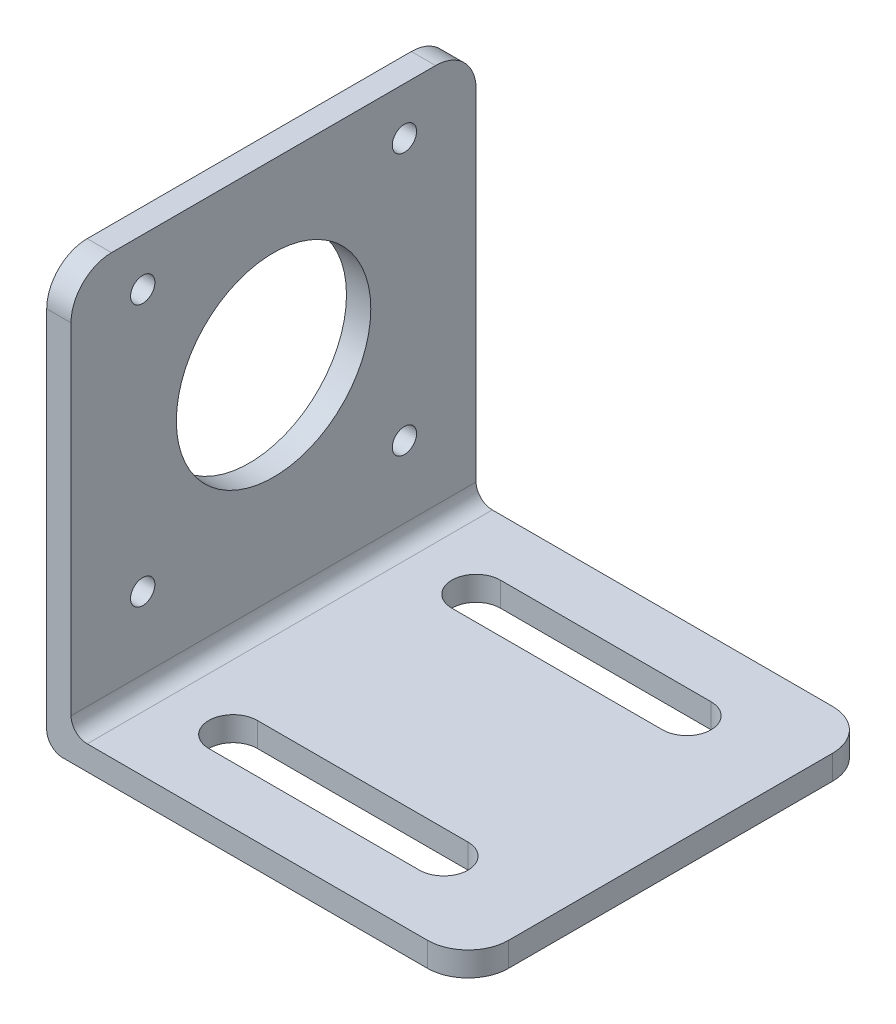
from build123d import *

# Parameters (mm, degrees)
BOSS_EXTRUDE1_DEPTH = 50
FILLET1_R           = 2
FILLET2_R           = 5
FILLET3_R           = 5
FILLET4_R           = 5
FILLET5_R           = 5
FILLET6_R           = 2
CUT_EXTRUDE1_DEPTH  = 50
SKETCH3_R           = 12
CUT_EXTRUDE2_DEPTH  = 50
SKETCH4_R           = 1.5
CUT_EXTRUDE3_DEPTH  = 10


with BuildPart() as part:
    # Sketch1 → Boss-Extrude1 (new body)
    with BuildSketch(Plane.XY):
        Polygon((0, 0), (52, 0), (52, 3), (3, 3), (3, 52), (0, 52), align=None)
    extrude(amount=BOSS_EXTRUDE1_DEPTH)

    # Fillet1
    fillet1_edges = [part.edges().sort_by_distance(p)[0] for p in [
        (0, 0, 25),
    ]]
    fillet(fillet1_edges, radius=FILLET1_R)

    # Fillet2
    fillet2_edges = [part.edges().sort_by_distance(p)[0] for p in [
        (1.5, 52, 50),
    ]]
    fillet(fillet2_edges, radius=FILLET2_R)

    # Fillet3
    fillet3_edges = [part.edges().sort_by_distance(p)[0] for p in [
        (52, 1.5, 50),
    ]]
    fillet(fillet3_edges, radius=FILLET3_R)

    # Fillet4
    fillet4_edges = [part.edges().sort_by_distance(p)[0] for p in [
        (52, 1.5, 0),
    ]]
    fillet(fillet4_edges, radius=FILLET4_R)

    # Fillet5
    fillet5_edges = [part.edges().sort_by_distance(p)[0] for p in [
        (1.5, 52, 0),
    ]]
    fillet(fillet5_edges, radius=FILLET5_R)

    # Fillet6
    fillet6_edges = [part.edges().sort_by_distance(p)[0] for p in [
        (3, 3, 25),
    ]]
    fillet(fillet6_edges, radius=FILLET6_R)

    # Sketch2 → Cut-Extrude1 (cut)
    with BuildSketch(Plane(origin=(0, 3, 0), x_dir=(1, 0, 0), z_dir=(0, 1, 0))):
        with BuildLine():
            Line((39, -43), (13, -43))
            ThreePointArc((13, -43), (10, -40), (13, -37))
            Line((13, -37), (39, -37))
            ThreePointArc((39, -37), (42, -40), (39, -43))
        make_face()
        with BuildLine():
            Line((13, -7), (39, -7))
            ThreePointArc((39, -7), (42, -10), (39, -13))
            Line((39, -13), (13, -13))
            ThreePointArc((13, -13), (10, -10), (13, -7))
        make_face()
    extrude(amount=-CUT_EXTRUDE1_DEPTH, mode=Mode.SUBTRACT)

    # Sketch3 → Cut-Extrude2 (cut)
    with BuildSketch(Plane.ZY):
        with Locations((25, 30)):
            Circle(SKETCH3_R)
    extrude(amount=-CUT_EXTRUDE2_DEPTH, mode=Mode.SUBTRACT)

    # Sketch4 → Cut-Extrude3 (cut)
    with BuildSketch(Plane(origin=(3, 0, 0), x_dir=(0, 0, -1), z_dir=(1, 0, 0))):
        with Locations((-8.85, 46.15)):
            Circle(SKETCH4_R)
        with Locations((-41.15, 46.15)):
            Circle(SKETCH4_R)
        with Locations((-8.85, 13.85)):
            Circle(SKETCH4_R)
        with Locations((-41.15, 13.85)):
            Circle(SKETCH4_R)
    extrude(amount=-CUT_EXTRUDE3_DEPTH, mode=Mode.SUBTRACT)


solid = part.part
